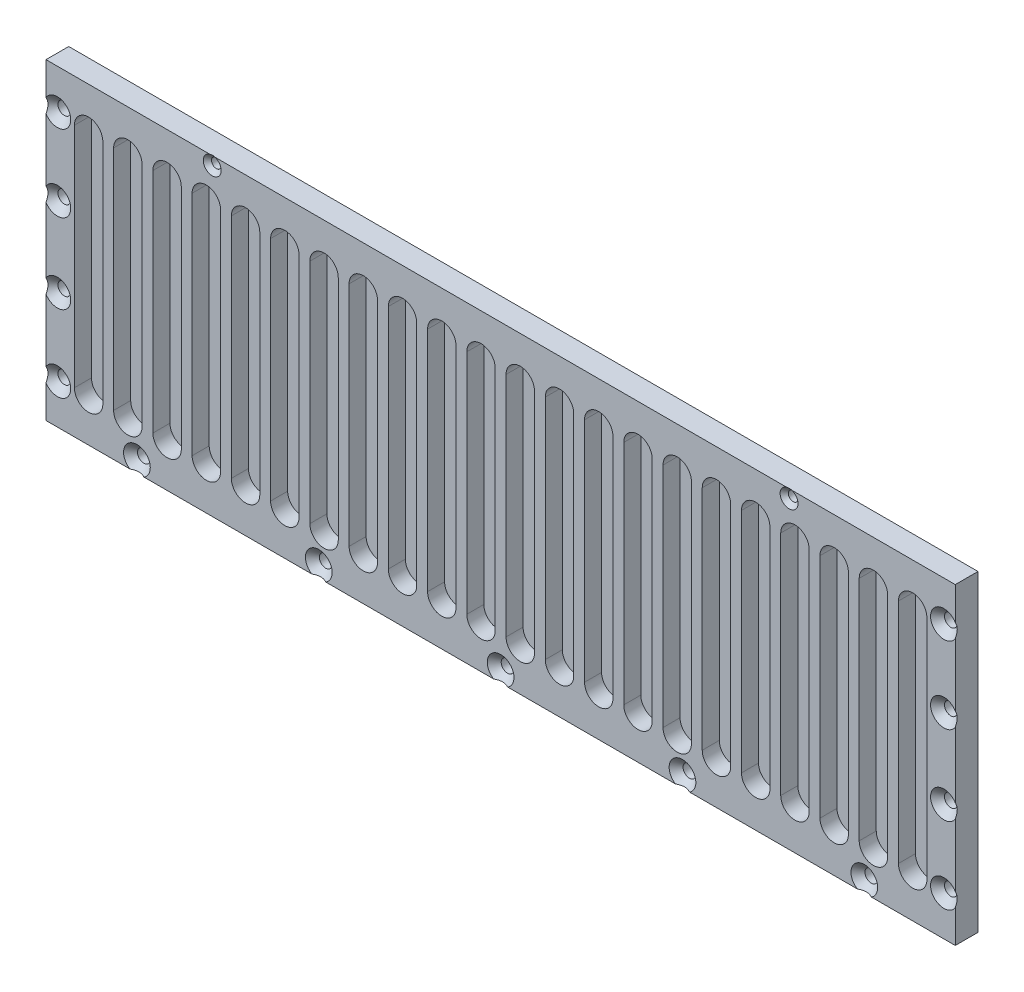
from build123d import *

# Parameters (mm, degrees)
SKETCH1_W                                       = 320
SKETCH1_H                                       = 110
EXTRUDE1_DEPTH                                  = 8
SKETCH2_R                                       = 1.75
CUT_EXTRUDE1_DEPTH                              = 170.378274876
CUT_EXTRUDE2_DEPTH                              = 6
SKETCH6_R                                       = 2.25
CUT_EXTRUDE3_DEPTH                              = 10
SKETCH9_R                                       = 1.5
CUT_EXTRUDE4_DEPTH                              = 10
CSK_FOR_M4_FLAT_HEAD_MACHINE_SCREW1_D           = 4.5
CSK_FOR_M4_FLAT_HEAD_MACHINE_SCREW1_CSINK_D     = 9.4
CSK_FOR_M4_FLAT_HEAD_MACHINE_SCREW1_CSINK_ANGLE = 90
CSK_FOR_M3_FLAT_HEAD_MACHINE_SCREW1_D           = 3.4
CSK_FOR_M3_FLAT_HEAD_MACHINE_SCREW1_CSINK_D     = 6.3
CSK_FOR_M3_FLAT_HEAD_MACHINE_SCREW1_CSINK_ANGLE = 90


with BuildPart() as part:
    # Sketch1 → Extrude1 (new body)
    with BuildSketch(Plane.XY):
        Rectangle(SKETCH1_W, SKETCH1_H)
    extrude(amount=EXTRUDE1_DEPTH)

    # Sketch2 → Cut-Extrude1 (cut, through all)
    with BuildSketch(Plane.XY.offset(8)):
        with Locations((156, 41)):
            Circle(SKETCH2_R)
        with Locations((156, 14)):
            Circle(SKETCH2_R)
        with Locations(Location((156, -14, 0), (0, 0, 180))):
            Circle(SKETCH2_R)
        with Locations(Location((156, -41, 0), (0, 0, 180))):
            Circle(SKETCH2_R)
        with Locations((-156, -41)):
            Circle(SKETCH2_R)
        with Locations((-156, -14)):
            Circle(SKETCH2_R)
        with Locations(Location((-156, 41, 0), (0, 0, 180))):
            Circle(SKETCH2_R)
        with Locations(Location((-156, 14, 0), (0, 0, 180))):
            Circle(SKETCH2_R)
    extrude(amount=-CUT_EXTRUDE1_DEPTH, mode=Mode.SUBTRACT)

    # Sketch5 → Cut-Extrude2 (cut)
    with BuildSketch(Plane.XY.offset(8)):
        with BuildLine():
            Line((150, 40), (150, -40))
            ThreePointArc((150, -40), (145, -45), (140, -40))
            Line((140, -40), (140, 40))
            ThreePointArc((140, 40), (145, 45), (150, 40))
        make_face()
        with BuildLine():
            Line((136.19047619, 40), (136.19047619, -40))
            ThreePointArc((136.19047619, -40), (131.19047619, -45), (126.19047619, -40))
            Line((126.19047619, -40), (126.19047619, 40))
            ThreePointArc((126.19047619, 40), (131.19047619, 45), (136.19047619, 40))
        make_face()
        with BuildLine():
            Line((122.380952381, 40), (122.380952381, -40))
            ThreePointArc((122.380952381, -40), (117.380952381, -45), (112.380952381, -40))
            Line((112.380952381, -40), (112.380952381, 40))
            ThreePointArc((112.380952381, 40), (117.380952381, 45), (122.380952381, 40))
        make_face()
        with BuildLine():
            Line((108.571428571, 40), (108.571428571, -40))
            ThreePointArc((108.571428571, -40), (103.571428571, -45), (98.571428571, -40))
            Line((98.571428571, -40), (98.571428571, 40))
            ThreePointArc((98.571428571, 40), (103.571428571, 45), (108.571428571, 40))
        make_face()
        with BuildLine():
            Line((94.761904762, 40), (94.761904762, -40))
            ThreePointArc((94.761904762, -40), (89.761904762, -45), (84.761904762, -40))
            Line((84.761904762, -40), (84.761904762, 40))
            ThreePointArc((84.761904762, 40), (89.761904762, 45), (94.761904762, 40))
        make_face()
        with BuildLine():
            Line((80.952380952, 40), (80.952380952, -40))
            ThreePointArc((80.952380952, -40), (75.952380952, -45), (70.952380952, -40))
            Line((70.952380952, -40), (70.952380952, 40))
            ThreePointArc((70.952380952, 40), (75.952380952, 45), (80.952380952, 40))
        make_face()
        with BuildLine():
            Line((67.142857143, 40), (67.142857143, -40))
            ThreePointArc((67.142857143, -40), (62.142857143, -45), (57.142857143, -40))
            Line((57.142857143, -40), (57.142857143, 40))
            ThreePointArc((57.142857143, 40), (62.142857143, 45), (67.142857143, 40))
        make_face()
        with BuildLine():
            Line((53.333333333, 40), (53.333333333, -40))
            ThreePointArc((53.333333333, -40), (48.333333333, -45), (43.333333333, -40))
            Line((43.333333333, -40), (43.333333333, 40))
            ThreePointArc((43.333333333, 40), (48.333333333, 45), (53.333333333, 40))
        make_face()
        with BuildLine():
            Line((39.523809524, 40), (39.523809524, -40))
            ThreePointArc((39.523809524, -40), (34.523809524, -45), (29.523809524, -40))
            Line((29.523809524, -40), (29.523809524, 40))
            ThreePointArc((29.523809524, 40), (34.523809524, 45), (39.523809524, 40))
        make_face()
        with BuildLine():
            Line((25.714285714, 40), (25.714285714, -40))
            ThreePointArc((25.714285714, -40), (20.714285714, -45), (15.714285714, -40))
            Line((15.714285714, -40), (15.714285714, 40))
            ThreePointArc((15.714285714, 40), (20.714285714, 45), (25.714285714, 40))
        make_face()
        with BuildLine():
            Line((11.904761905, 40), (11.904761905, -40))
            ThreePointArc((11.904761905, -40), (6.904761905, -45), (1.904761905, -40))
            Line((1.904761905, -40), (1.904761905, 40))
            ThreePointArc((1.904761905, 40), (6.904761905, 45), (11.904761905, 40))
        make_face()
        with BuildLine():
            Line((-1.904761905, 40), (-1.904761905, -40))
            ThreePointArc((-1.904761905, -40), (-6.904761905, -45), (-11.904761905, -40))
            Line((-11.904761905, -40), (-11.904761905, 40))
            ThreePointArc((-11.904761905, 40), (-6.904761905, 45), (-1.904761905, 40))
        make_face()
        with BuildLine():
            Line((-15.714285714, 40), (-15.714285714, -40))
            ThreePointArc((-15.714285714, -40), (-20.714285714, -45), (-25.714285714, -40))
            Line((-25.714285714, -40), (-25.714285714, 40))
            ThreePointArc((-25.714285714, 40), (-20.714285714, 45), (-15.714285714, 40))
        make_face()
        with BuildLine():
            Line((-29.523809524, 40), (-29.523809524, -40))
            ThreePointArc((-29.523809524, -40), (-34.523809524, -45), (-39.523809524, -40))
            Line((-39.523809524, -40), (-39.523809524, 40))
            ThreePointArc((-39.523809524, 40), (-34.523809524, 45), (-29.523809524, 40))
        make_face()
        with BuildLine():
            Line((-43.333333333, 40), (-43.333333333, -40))
            ThreePointArc((-43.333333333, -40), (-48.333333333, -45), (-53.333333333, -40))
            Line((-53.333333333, -40), (-53.333333333, 40))
            ThreePointArc((-53.333333333, 40), (-48.333333333, 45), (-43.333333333, 40))
        make_face()
        with BuildLine():
            Line((-57.142857143, 40), (-57.142857143, -40))
            ThreePointArc((-57.142857143, -40), (-62.142857143, -45), (-67.142857143, -40))
            Line((-67.142857143, -40), (-67.142857143, 40))
            ThreePointArc((-67.142857143, 40), (-62.142857143, 45), (-57.142857143, 40))
        make_face()
        with BuildLine():
            Line((-70.952380952, 40), (-70.952380952, -40))
            ThreePointArc((-70.952380952, -40), (-75.952380952, -45), (-80.952380952, -40))
            Line((-80.952380952, -40), (-80.952380952, 40))
            ThreePointArc((-80.952380952, 40), (-75.952380952, 45), (-70.952380952, 40))
        make_face()
        with BuildLine():
            Line((-84.761904762, 40), (-84.761904762, -40))
            ThreePointArc((-84.761904762, -40), (-89.761904762, -45), (-94.761904762, -40))
            Line((-94.761904762, -40), (-94.761904762, 40))
            ThreePointArc((-94.761904762, 40), (-89.761904762, 45), (-84.761904762, 40))
        make_face()
        with BuildLine():
            Line((-98.571428571, 40), (-98.571428571, -40))
            ThreePointArc((-98.571428571, -40), (-103.571428571, -45), (-108.571428571, -40))
            Line((-108.571428571, -40), (-108.571428571, 40))
            ThreePointArc((-108.571428571, 40), (-103.571428571, 45), (-98.571428571, 40))
        make_face()
        with BuildLine():
            Line((-112.380952381, 40), (-112.380952381, -40))
            ThreePointArc((-112.380952381, -40), (-117.380952381, -45), (-122.380952381, -40))
            Line((-122.380952381, -40), (-122.380952381, 40))
            ThreePointArc((-122.380952381, 40), (-117.380952381, 45), (-112.380952381, 40))
        make_face()
        with BuildLine():
            Line((-126.19047619, 40), (-126.19047619, -40))
            ThreePointArc((-126.19047619, -40), (-131.19047619, -45), (-136.19047619, -40))
            Line((-136.19047619, -40), (-136.19047619, 40))
            ThreePointArc((-136.19047619, 40), (-131.19047619, 45), (-126.19047619, 40))
        make_face()
        with BuildLine():
            Line((-140, 40), (-140, -40))
            ThreePointArc((-140, -40), (-145, -45), (-150, -40))
            Line((-150, -40), (-150, 40))
            ThreePointArc((-150, 40), (-145, 45), (-140, 40))
        make_face()
    extrude(amount=-CUT_EXTRUDE2_DEPTH, mode=Mode.SUBTRACT)

    # Sketch6 → Cut-Extrude3 (cut)
    with BuildSketch(Plane.XY.offset(8)):
        with Locations((-64, -51)):
            Circle(SKETCH6_R)
        with Locations((0, -51)):
            Circle(SKETCH6_R)
        with Locations((64, -51)):
            Circle(SKETCH6_R)
        with Locations((-128, -51)):
            Circle(SKETCH6_R)
        with Locations((128, -51)):
            Circle(SKETCH6_R)
    extrude(amount=-CUT_EXTRUDE3_DEPTH, mode=Mode.SUBTRACT)

    # Sketch9 → Cut-Extrude4 (cut)
    with BuildSketch(Plane.XY.offset(8)):
        with Locations((101.5, 52)):
            Circle(SKETCH9_R)
        with Locations((-101.5, 52)):
            Circle(SKETCH9_R)
    extrude(amount=-CUT_EXTRUDE4_DEPTH, mode=Mode.SUBTRACT)

    # CSK for M4 Flat Head Machine Screw1 (through all)
    with Locations(Plane.XY.offset(8)):
        with Locations((156, 41), (156, 14), (156, -14), (156, -41), (-156, -41), (-156, -14), (-156, 14), (-156, 41), (-128, -51), (-64, -51), (0, -51), (64, -51), (128, -51)):
            CounterSinkHole(CSK_FOR_M4_FLAT_HEAD_MACHINE_SCREW1_D / 2, CSK_FOR_M4_FLAT_HEAD_MACHINE_SCREW1_CSINK_D / 2, counter_sink_angle=CSK_FOR_M4_FLAT_HEAD_MACHINE_SCREW1_CSINK_ANGLE)

    # CSK for M3 Flat Head Machine Screw1 (through all)
    with Locations(Plane.XY.offset(8)):
        with Locations((-101.5, 52), (101.5, 52)):
            CounterSinkHole(CSK_FOR_M3_FLAT_HEAD_MACHINE_SCREW1_D / 2, CSK_FOR_M3_FLAT_HEAD_MACHINE_SCREW1_CSINK_D / 2, counter_sink_angle=CSK_FOR_M3_FLAT_HEAD_MACHINE_SCREW1_CSINK_ANGLE)


solid = part.part
